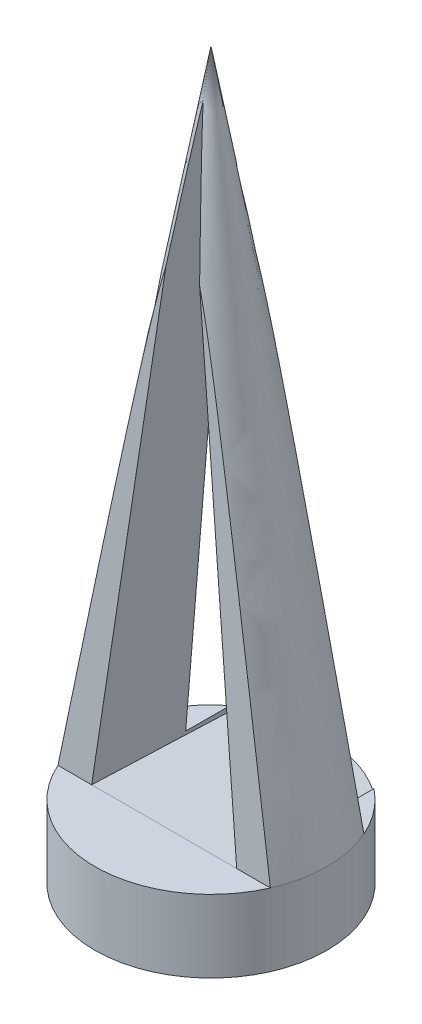
from build123d import *

# Parameters (mm, degrees)
CUT_EXTRUDE1_DEPTH      = 103.528044944
CUT_EXTRUDE1_DEPTH_BACK = 103.528044944
CUT_EXTRUDE2_DEPTH      = 104.553789555
CUT_EXTRUDE2_DEPTH_BACK = 104.553789555


with BuildPart() as part:
    # Sketch1 → Revolve1 (revolve)
    with BuildSketch(Plane.XY, mode=Mode.PRIVATE) as revolve1_sk:
        Polygon((0, 100), (-16, 10), (-16, 0), (0, 0), align=None)
    revolve(revolve1_sk.sketch.rotate(Axis((0, 0, 0), (0, 1, 0)), 270), axis=Axis((0, 0, 0), (0, 1, 0)))

    # Sketch3 → Cut-Extrude1 (cut, two sides: drawn at the far end of the back side and taken through both)
    with BuildSketch(Plane(origin=(0, 0, 0), x_dir=(0, 0, -1), z_dir=(1, 0, 0)).offset(-CUT_EXTRUDE1_DEPTH_BACK)):
        Polygon((-29.451982923, 10), (-6.451982923, 10), (-2.451982923, 110.819600833), (-29.451982923, 110.819600833), align=None)
        Polygon((29.451982923, 10), (6.451982923, 10), (2.451982923, 110.819600833), (29.451982923, 110.819600833), align=None)
    extrude(amount=CUT_EXTRUDE1_DEPTH + CUT_EXTRUDE1_DEPTH_BACK, mode=Mode.SUBTRACT)

    # Sketch4 → Cut-Extrude2 (cut, two sides: drawn at the far end of the back side and taken through both)
    with BuildSketch(Plane(origin=(0, 0.271295166, 6.837967583), x_dir=(1, 0, 0), z_dir=(0, 0.03964363571474905, 0.9992138820829684)).offset(-CUT_EXTRUDE2_DEPTH_BACK)):
        Polygon((-10, 9.73635876), (10, 9.73635876), (0, 93.839476738), align=None)
    extrude(amount=CUT_EXTRUDE2_DEPTH + CUT_EXTRUDE2_DEPTH_BACK, mode=Mode.SUBTRACT)


solid = part.part
